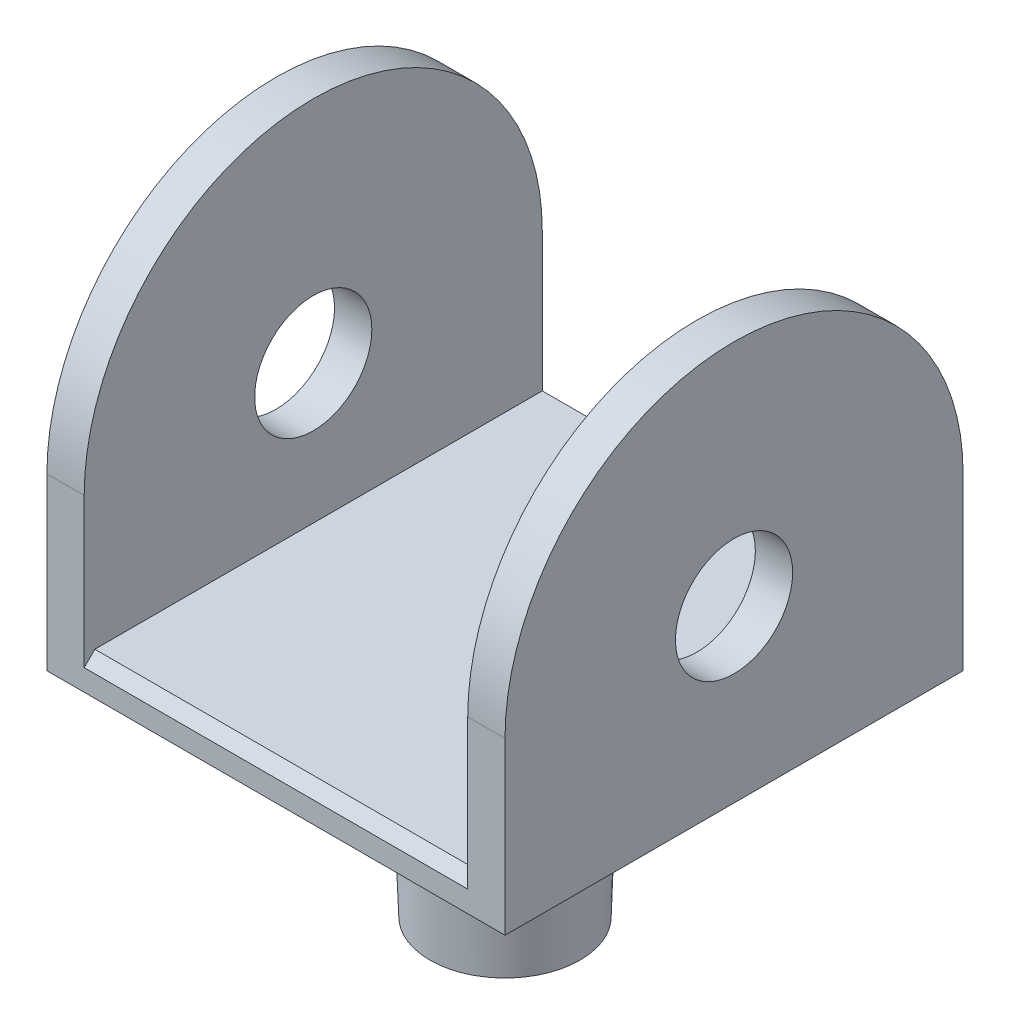
from build123d import *

# Parameters (mm, degrees)
SKETCH3_W           = 86
SKETCH3_H           = 86
BOSS_EXTRUDE1_DEPTH = 6
FILLET2_R           = 2
BOSS_EXTRUDE2_START = 43
SKETCH4_R           = 11
BOSS_EXTRUDE2_DEPTH = 86
SKETCH4_2_R         = 11
CUT_EXTRUDE1_DEPTH  = 36
CHAMFER2_SIZE       = 2


with BuildPart() as part:
    # Sketch2 → Revolve1 (revolve)
    with BuildSketch(Plane.XY, mode=Mode.PRIVATE) as revolve1_sk:
        Polygon((0, 0), (15.5, 0), (14.10316922, -40), (0, -40), align=None)
    revolve(revolve1_sk.sketch.rotate(Axis((0, -16.883928571, 0), (0, 1, 0)), 90), axis=Axis((0, -16.883928571, 0), (0, 1, 0)))

    # Sketch3 → Boss-Extrude1 (add)
    with BuildSketch(Plane(origin=(0, 0, 0), x_dir=(1, 0, 0), z_dir=(0, 1, 0))):
        Rectangle(SKETCH3_W, SKETCH3_H)
    extrude(amount=BOSS_EXTRUDE1_DEPTH)

    # Fillet2
    fillet2_edges = [part.edges().sort_by_distance(p)[0] for p in [
        (0, 0, 15.5),
    ]]
    fillet(fillet2_edges, radius=FILLET2_R)

    # Sketch4 → Boss-Extrude2 (add)
    with BuildSketch(Plane(origin=(0, 0, 0), x_dir=(0, 0, -1), z_dir=(1, 0, 0)).offset(BOSS_EXTRUDE2_START)):
        with BuildLine():
            Line((-43, 6), (43, 6))
            Line((43, 6), (43, 32))
            ThreePointArc((43, 32), (0, 75), (-43, 32))
            Line((-43, 32), (-43, 6))
        make_face()
        with Locations((0, 32)):
            Circle(SKETCH4_R, mode=Mode.SUBTRACT)
    extrude(amount=-BOSS_EXTRUDE2_DEPTH)

    # Sketch4<2> → Cut-Extrude1 (cut, symmetric)
    with BuildSketch(Plane(origin=(0, 0, 0), x_dir=(0, 0, -1), z_dir=(1, 0, 0))):
        with BuildLine():
            Line((-43, 6), (43, 6))
            Line((43, 6), (43, 32))
            ThreePointArc((43, 32), (0, 75), (-43, 32))
            Line((-43, 32), (-43, 6))
        make_face()
        with Locations((0, 32)):
            Circle(SKETCH4_2_R, mode=Mode.SUBTRACT)
    extrude(amount=CUT_EXTRUDE1_DEPTH, both=True, mode=Mode.SUBTRACT)

    # Chamfer2
    chamfer2_edges = [part.edges().sort_by_distance(p)[0] for p in [
        (0, 6, 43),
    ]]
    chamfer(chamfer2_edges, length=CHAMFER2_SIZE)


solid = part.part
